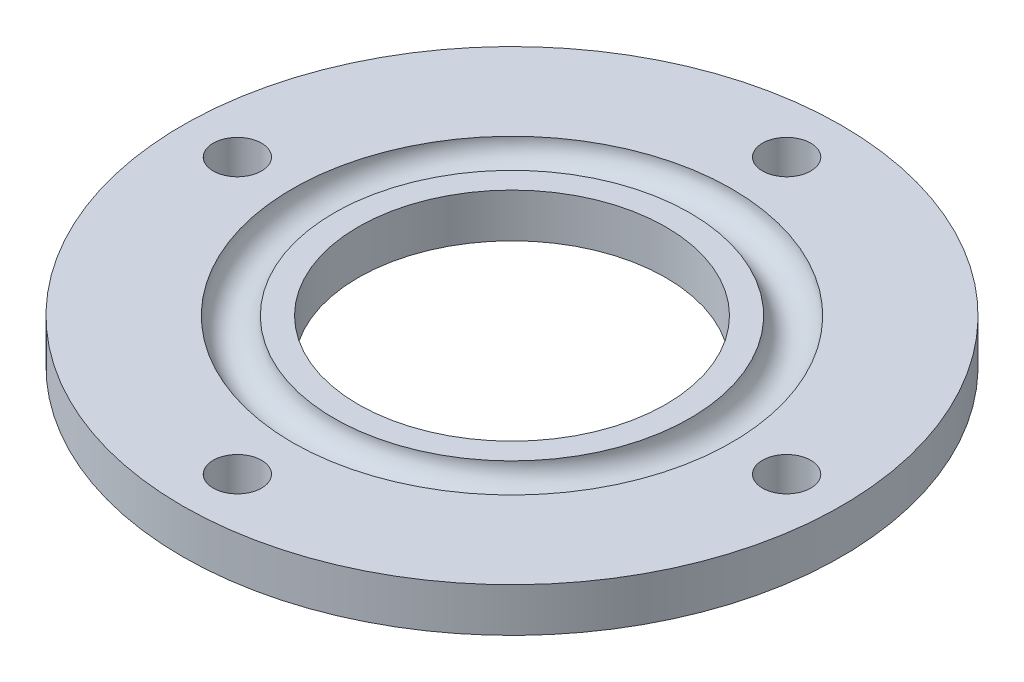
from build123d import *

# Parameters (mm, degrees)
SKETCH_1_R          = 15
SKETCH_1_R_2        = 7
EXTRUDE_1_DEPTH     = 2
CUT_EXTRUDE_1_REACH = 23.307
SKETCH_2_R          = 1.1
SKETCH_3_R          = 0.95


with BuildPart() as part:
    # 草图1 → 凸台-拉伸1 (new body)
    with BuildSketch(Plane(origin=(0, 0, 0), x_dir=(1, 0, 0), z_dir=(0, 1, 0))):
        with Locations(Location((0, 0, 0), (0, 0, 270))):
            Circle(SKETCH_1_R)
        with Locations(Location((0, 0, 0), (0, 0, 270))):
            Circle(SKETCH_1_R_2, mode=Mode.SUBTRACT)
    extrude(amount=EXTRUDE_1_DEPTH)

    # 草图2 → 切除-拉伸1 (cut, up to next)
    with BuildSketch(Plane(origin=(0, 2, 0), x_dir=(1, 0, 0), z_dir=(0, 1, 0)), mode=Mode.PRIVATE) as cut_extrude_1_sk1:
        with Locations(Location((12.5, 0, 0), (0, 0, 270))):
            Circle(SKETCH_2_R)
    cut_extrude_1_tool1 = extrude(cut_extrude_1_sk1.sketch, amount=-CUT_EXTRUDE_1_REACH, mode=Mode.PRIVATE) & part.part
    # 草图2 → 切除-拉伸1 (cut, up to next)
    with BuildSketch(Plane(origin=(0, 2, 0), x_dir=(1, 0, 0), z_dir=(0, 1, 0)), mode=Mode.PRIVATE) as cut_extrude_1_sk2:
        with Locations(Location((0, -12.5, 0), (0, 0, 270))):
            Circle(SKETCH_2_R)
    cut_extrude_1_tool2 = extrude(cut_extrude_1_sk2.sketch, amount=-CUT_EXTRUDE_1_REACH, mode=Mode.PRIVATE) & part.part
    # 草图2 → 切除-拉伸1 (cut, up to next)
    with BuildSketch(Plane(origin=(0, 2, 0), x_dir=(1, 0, 0), z_dir=(0, 1, 0)), mode=Mode.PRIVATE) as cut_extrude_1_sk3:
        with Locations(Location((-12.5, 0, 0), (0, 0, 270))):
            Circle(SKETCH_2_R)
    cut_extrude_1_tool3 = extrude(cut_extrude_1_sk3.sketch, amount=-CUT_EXTRUDE_1_REACH, mode=Mode.PRIVATE) & part.part
    # 草图2 → 切除-拉伸1 (cut, up to next)
    with BuildSketch(Plane(origin=(0, 2, 0), x_dir=(1, 0, 0), z_dir=(0, 1, 0)), mode=Mode.PRIVATE) as cut_extrude_1_sk4:
        with Locations(Location((0, 12.5, 0), (0, 0, 270))):
            Circle(SKETCH_2_R)
    cut_extrude_1_tool4 = extrude(cut_extrude_1_sk4.sketch, amount=-CUT_EXTRUDE_1_REACH, mode=Mode.PRIVATE) & part.part
    add(cut_extrude_1_tool1.solids().sort_by_distance((12.5, 2, 0))[0], mode=Mode.SUBTRACT)
    add(cut_extrude_1_tool2.solids().sort_by_distance((0, 2, 12.5))[0], mode=Mode.SUBTRACT)
    add(cut_extrude_1_tool3.solids().sort_by_distance((-12.5, 2, 0))[0], mode=Mode.SUBTRACT)
    add(cut_extrude_1_tool4.solids().sort_by_distance((0, 2, -12.5))[0], mode=Mode.SUBTRACT)

    # 草图3 → 切除-旋转1 (revolve, cut)
    with BuildSketch(Plane.XY, mode=Mode.PRIVATE) as cut_revolve_1_sk:
        with Locations((9.05, 2)):
            Circle(SKETCH_3_R)
    revolve(cut_revolve_1_sk.sketch.rotate(Axis((0, 2, 0), (0, 1, 0)), 90), axis=Axis((0, 2, 0), (0, 1, 0)), mode=Mode.SUBTRACT)


solid = part.part
